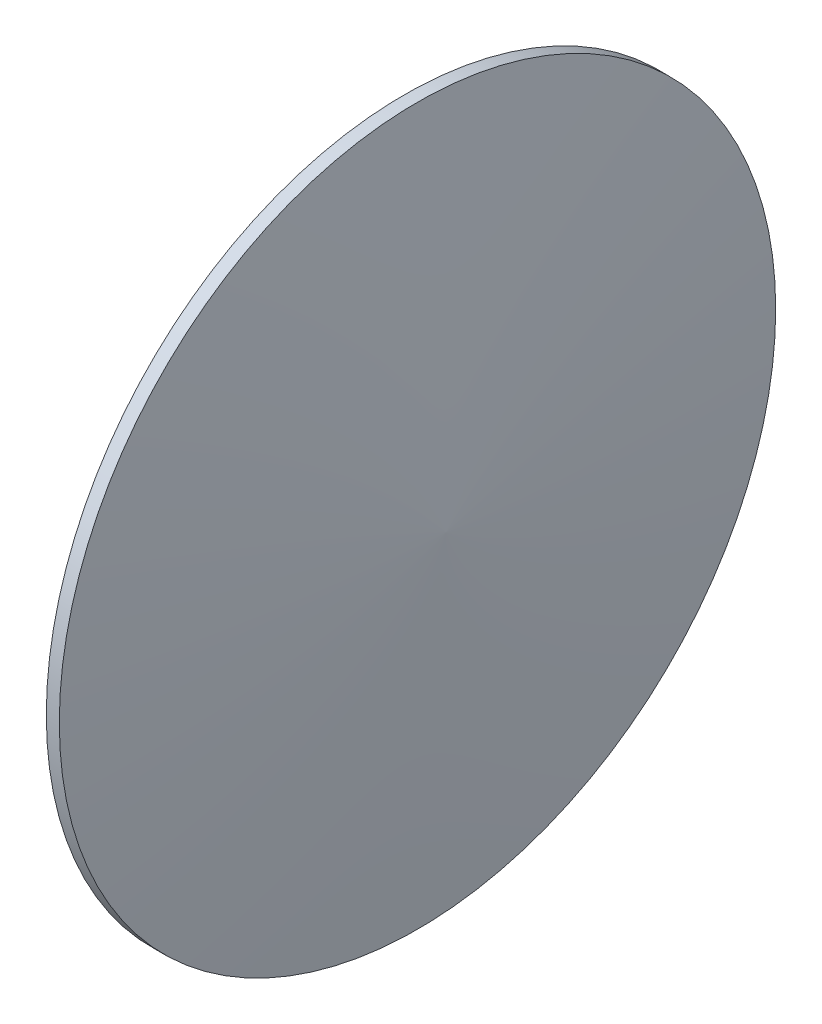
from build123d import *


with BuildPart() as part:
    # 草图1 → 旋转1 (revolve)
    with BuildSketch(Plane.XY, mode=Mode.PRIVATE) as revolve_1_sk:
        with BuildLine():
            Line((143.38637636, 13.840596334), (143.214015058, 13.840596334))
            ThreePointArc((143.214015058, 13.840596334), (142.941915932, 11.468247193), (142.72088476, 9.090596334))
            Line((142.72088476, 9.090596334), (143.325098661, 9.090596334))
            Line((143.325098661, 9.090596334), (143.765698589, 9.090596334))
            ThreePointArc((143.765698589, 9.090596334), (143.595679468, 11.467164891), (143.38637636, 13.840596334))
        make_face()
    revolve(revolve_1_sk.sketch.rotate(Axis((143.765698589, 9.090596334, 0), (-1, 0, 0)), 90), axis=Axis((143.765698589, 9.090596334, 0), (-1, 0, 0)))


solid = part.part
